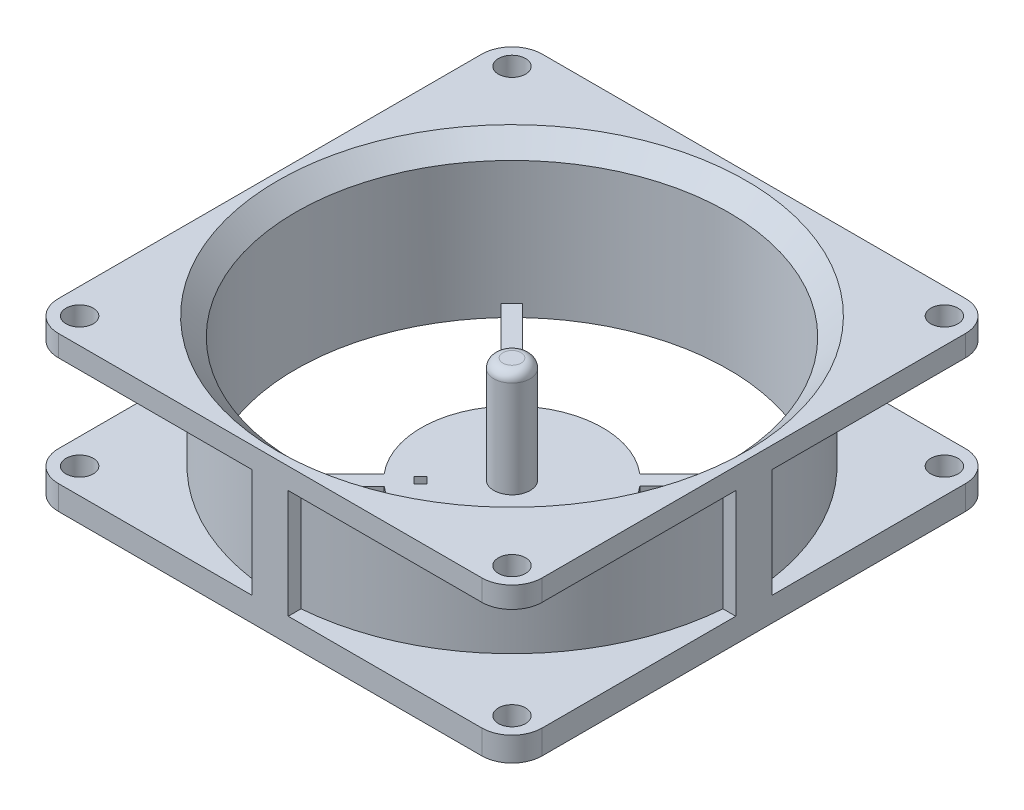
from build123d import *

# Parameters (mm, degrees)
SKETCH1_W            = 80
SKETCH1_H            = 80
BOSS_EXTRUDE1_DEPTH  = 25.5
SKETCH2_R            = 35.75
CUT_EXTRUDE2_DEPTH   = 28
BOSS_EXTRUDE2_START  = -2
BOSS_EXTRUDE2_DEPTH  = 2
CIRPATTERN2_COUNT    = 4
SKETCH5_R            = 15
BOSS_EXTRUDE3_DEPTH  = 2
SKETCH6_R            = 3
BOSS_EXTRUDE4_DEPTH  = 17.5
FILLET1_R            = 1.5
SKETCH7_R            = 70
SKETCH7_R_2          = 38
CUT_EXTRUDE4_DEPTH   = 18
FILLET2_R            = 5
BOSS_EXTRUDE5_START  = -20
BOSS_EXTRUDE5_DEPTH  = 20
CIRPATTERN3_COUNT    = 4
SKETCH9_R            = 2.25
CUT_EXTRUDE5_DEPTH   = 37
LPATTERN1_COUNT      = 2
LPATTERN1_PITCH      = 71.5
LPATTERN1_COUNT_DIR2 = 2
LPATTERN1_PITCH_DIR2 = 71.5
CHAMFER2_SIZE        = 3
CUT_EXTRUDE6_DEPTH   = 1
CUT_EXTRUDE7_DEPTH   = 7


with BuildPart() as part:
    # Sketch1 → Boss-Extrude1 (new body)
    with BuildSketch(Plane(origin=(0, 0, 0), x_dir=(1, 0, 0), z_dir=(0, 1, 0))):
        Rectangle(SKETCH1_W, SKETCH1_H)
    extrude(amount=BOSS_EXTRUDE1_DEPTH)

    # Sketch2 → Cut-Extrude2 (cut)
    with BuildSketch(Plane(origin=(0, 25.5, 0), x_dir=(1, 0, 0), z_dir=(0, 1, 0))):
        with Locations(Location((0, 0, 0), (0, 0, 270))):
            Circle(SKETCH2_R)
    extrude(amount=-CUT_EXTRUDE2_DEPTH, mode=Mode.SUBTRACT)

    # Sketch4 → Boss-Extrude2 (add)
    with BuildSketch(Plane.XZ.offset(BOSS_EXTRUDE2_START)):
        with BuildLine():
            Line((-1.75, 0), (0, 1.785533906))
            Line((0, 1.785533906), (-24.370530875, 26.156064781))
            ThreePointArc((-24.370530875, 26.156064781), (-25.270176953, 25.287954776), (-26.138919431, 24.388919431))
            Line((-26.138919431, 24.388919431), (-1.75, 0))
        make_face()
    boss_extrude2 = extrude(amount=BOSS_EXTRUDE2_DEPTH)

    # CirPattern2: Boss-Extrude2 ×4 about axis
    cirpattern2_axis = Axis((0, 0, 0), (0, 1, 0))
    for i in range(1, CIRPATTERN2_COUNT):
        add(boss_extrude2.rotate(cirpattern2_axis, i * 360 / CIRPATTERN2_COUNT))

    # Sketch5 → Boss-Extrude3 (add)
    with BuildSketch(Plane.XZ):
        Circle(SKETCH5_R)
    extrude(amount=-BOSS_EXTRUDE3_DEPTH)

    # Sketch6 → Boss-Extrude4 (add)
    with BuildSketch(Plane(origin=(0, 2, 0), x_dir=(1, 0, 0), z_dir=(0, 1, 0))):
        with Locations(Location((0, 0, 0), (0, 0, 90))):
            Circle(SKETCH6_R)
    extrude(amount=BOSS_EXTRUDE4_DEPTH)

    # Fillet1
    fillet1_edges = [part.edges().sort_by_distance(p)[0] for p in [
        (0, 19.5, 3),
    ]]
    fillet(fillet1_edges, radius=FILLET1_R)

    # Sketch7 → Cut-Extrude4 (cut)
    with BuildSketch(Plane.XZ.offset(-4)):
        Circle(SKETCH7_R)
        with Locations(Location((0, 0, 0), (0, 0, 270))):
            Circle(SKETCH7_R_2, mode=Mode.SUBTRACT)
    extrude(amount=-CUT_EXTRUDE4_DEPTH, mode=Mode.SUBTRACT)

    # Fillet2
    fillet2_edges = [part.edges().sort_by_distance(p)[0] for p in [
        (-40, 2, -40),
        (40, 2, -40),
        (40, 2, 40),
        (-40, 2, 40),
        (-40, 23.75, -40),
        (40, 23.75, -40),
        (40, 23.75, 40),
        (-40, 23.75, 40),
    ]]
    fillet(fillet2_edges, radius=FILLET2_R)

    # Sketch8 → Boss-Extrude5 (add)
    with BuildSketch(Plane.XZ.offset(-4).offset(BOSS_EXTRUDE5_START)):
        with BuildLine():
            Line((-3, 40), (3, 40))
            Line((3, 40), (3, 35.623903492))
            ThreePointArc((3, 35.623903492), (0, 35.75), (-3, 35.623903492))
            Line((-3, 35.623903492), (-3, 40))
        make_face()
    boss_extrude5 = extrude(amount=BOSS_EXTRUDE5_DEPTH)

    # CirPattern3: Boss-Extrude5 ×4 about axis
    cirpattern3_axis = Axis((0, 0, 0), (0, 1, 0))
    for i in range(1, CIRPATTERN3_COUNT):
        add(boss_extrude5.rotate(cirpattern3_axis, i * 360 / CIRPATTERN3_COUNT))

    # Sketch9 → Cut-Extrude5 (cut)
    with BuildSketch(Plane(origin=(0, 25.5, 0), x_dir=(-1, 0, 0), z_dir=(0, 1, 0))):
        with Locations(Location((35.75, -35.75, 0), (0, 0, 90))):
            Circle(SKETCH9_R)
    cut_extrude5 = extrude(amount=-CUT_EXTRUDE5_DEPTH, mode=Mode.SUBTRACT)

    # LPattern1: Cut-Extrude5 2 × 2
    with Locations(*[(i * LPATTERN1_PITCH, 0, j * LPATTERN1_PITCH_DIR2) for i in range(LPATTERN1_COUNT) for j in range(LPATTERN1_COUNT_DIR2) if (i, j) != (0, 0)]):
        add(cut_extrude5, mode=Mode.SUBTRACT)

    # Chamfer2
    chamfer2_edges = [part.edges().sort_by_distance(p)[0] for p in [
        (0, 25.5, -35.75),
    ]]
    chamfer(chamfer2_edges, length=CHAMFER2_SIZE)

    # Sketch11 → Cut-Extrude6 (cut)
    with BuildSketch(Plane.XZ):
        Polygon((-28.863216429, 27.820323211), (-7.554875149, 6.51198193), (-6.494214977, 7.572642102), (-28.241896086, 29.320323211), (-40, 29.320323211), (-40, 27.820323211), align=None)
    extrude(amount=-CUT_EXTRUDE6_DEPTH, mode=Mode.SUBTRACT)

    # Sketch12 → Cut-Extrude7 (cut)
    with BuildSketch(Plane.XZ.offset(-1)):
        Polygon((-6.494214977, 7.572642102), (-7.554875149, 8.633302273), (-8.61553532, 7.572642102), (-7.554875149, 6.51198193), align=None)
    extrude(amount=-CUT_EXTRUDE7_DEPTH, mode=Mode.SUBTRACT)


solid = part.part
